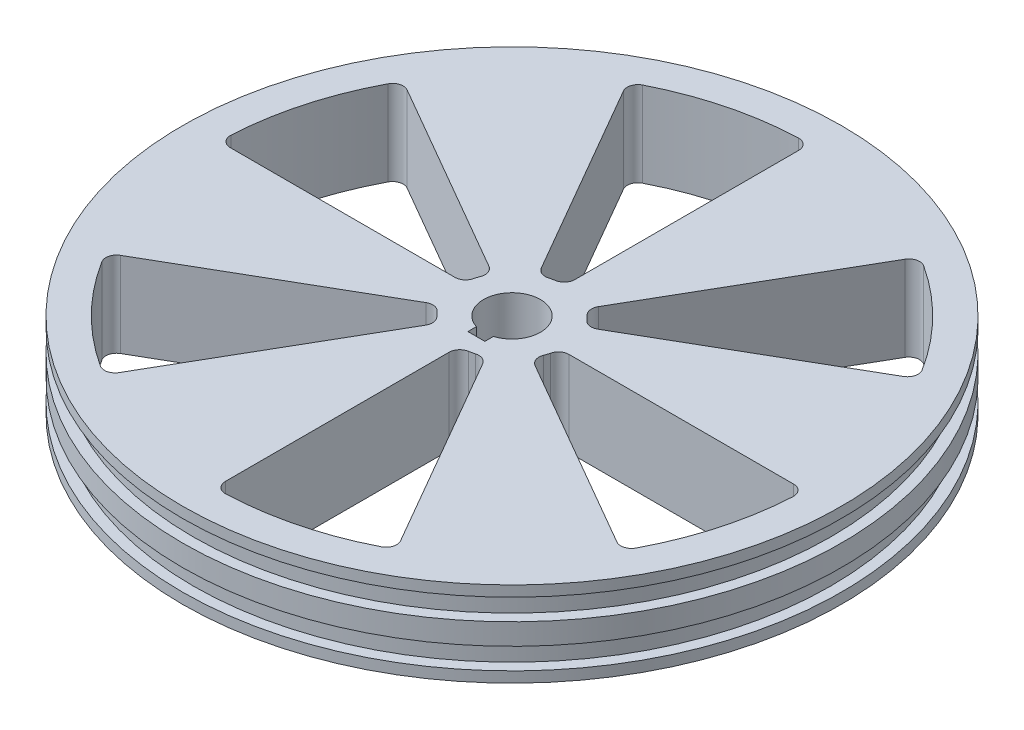
from build123d import *

# Parameters (mm, degrees)
CUT_EXTRUDE1_DEPTH = 223.822799552
CUT_EXTRUDE2_DEPTH = 223.822799552


with BuildPart() as part:
    # Sketch1 → Revolve1 (revolve)
    with BuildSketch(Plane(origin=(0, 0, 0), x_dir=(0, 0, -1), z_dir=(1, 0, 0))):
        Polygon((13.36858006, 0), (155, 0), (155, 5), (150, 5), (150, 15), (155, 15), (155, 25), (150, 25), (150, 35), (155, 35), (155, 40), (13.36858006, 40), align=None)
    revolve(axis=Axis((0, 0, 0), (0, 1, 0)))

    # Sketch2 → Cut-Extrude1 (cut, through all)
    with BuildSketch(Plane.XZ):
        with BuildLine():
            Line((-4, 16.756133146), (4, 16.756133146))
            Line((4, 16.756133146), (4, 12.756133146))
            ThreePointArc((4, 12.756133146), (0, 13.36858006), (-4, 12.756133146))
            Line((-4, 12.756133146), (-4, 16.756133146))
        make_face()
    extrude(amount=-CUT_EXTRUDE1_DEPTH, mode=Mode.SUBTRACT)

    # Sketch3 → Cut-Extrude2 (cut, through all)
    with BuildSketch(Plane.XZ):
        with BuildLine():
            Line((0, 29.580398915), (0, 134.82214713))
            ThreePointArc((0, 134.82214713), (1.530598787, 138.422599216), (5.18530209, 139.818712264))
            ThreePointArc((5.18530209, 139.818712264), (35.071098816, 135.448062683), (63.322556568, 124.765433861))
            ThreePointArc((63.322556568, 124.765433861), (65.852633094, 121.73068432), (65.389787061, 117.806813075))
            Line((65.389787061, 117.806813075), (12.582866204, 26.34254316))
            ThreePointArc((12.582866204, 26.34254316), (10.127088699, 24.207156024), (6.877282654, 24.035452633))
            ThreePointArc((6.877282654, 24.035452633), (5.530526507, 24.380592211), (4.166666667, 24.65033243))
            ThreePointArc((4.166666667, 24.65033243), (1.181186921, 26.352912794), (0, 29.580398915))
        make_face()
        with BuildLine():
            Line((25.617376915, 14.790199458), (116.759404407, 67.411073565))
            ThreePointArc((116.759404407, 67.411073565), (120.642786773, 67.885762175), (123.67920779, 65.418752795))
            ThreePointArc((123.67920779, 65.418752795), (134.837012585, 37.351568828), (139.711313522, 7.543774309))
            ThreePointArc((139.711313522, 7.543774309), (138.348181588, 3.835288995), (134.718586392, 2.274189795))
            Line((134.718586392, 2.274189795), (29.104744679, 2.274189795))
            ThreePointArc((29.104744679, 2.274189795), (26.027556419, 3.333261933), (24.253953899, 6.061824829))
            ThreePointArc((24.253953899, 6.061824829), (23.879475467, 7.400719654), (23.431147429, 8.716727032))
            ThreePointArc((23.431147429, 8.716727032), (23.412885403, 12.153518517), (25.617376915, 14.790199458))
        make_face()
        with BuildLine():
            Line((25.617376915, -14.790199458), (116.759404407, -67.411073565))
            ThreePointArc((116.759404407, -67.411073565), (119.112187985, -70.536837041), (118.4939057, -74.399959468))
            ThreePointArc((118.4939057, -74.399959468), (99.765913769, -98.096493855), (76.388756953, -117.221659551))
            ThreePointArc((76.388756953, -117.221659551), (72.495548494, -117.895395325), (69.328799331, -115.53262328))
            Line((69.328799331, -115.53262328), (16.521878475, -24.068353365))
            ThreePointArc((16.521878475, -24.068353365), (15.900467721, -20.873894091), (17.376671245, -17.973627804))
            ThreePointArc((17.376671245, -17.973627804), (18.348948961, -16.979872557), (19.264480762, -15.933605397))
            ThreePointArc((19.264480762, -15.933605397), (22.231698483, -14.199394277), (25.617376915, -14.790199458))
        make_face()
        with BuildLine():
            Line((0, -29.580398915), (0, -134.82214713))
            ThreePointArc((0, -134.82214713), (-1.530598787, -138.422599216), (-5.18530209, -139.818712264))
            ThreePointArc((-5.18530209, -139.818712264), (-35.071098816, -135.448062683), (-63.322556568, -124.765433861))
            ThreePointArc((-63.322556568, -124.765433861), (-65.852633094, -121.73068432), (-65.389787061, -117.806813075))
            Line((-65.389787061, -117.806813075), (-12.582866204, -26.34254316))
            ThreePointArc((-12.582866204, -26.34254316), (-10.127088699, -24.207156024), (-6.877282654, -24.035452633))
            ThreePointArc((-6.877282654, -24.035452633), (-5.530526507, -24.380592211), (-4.166666667, -24.65033243))
            ThreePointArc((-4.166666667, -24.65033243), (-1.181186921, -26.352912794), (0, -29.580398915))
        make_face()
        with BuildLine():
            Line((-25.617376915, -14.790199458), (-116.759404407, -67.411073565))
            ThreePointArc((-116.759404407, -67.411073565), (-120.642786773, -67.885762175), (-123.67920779, -65.418752795))
            ThreePointArc((-123.67920779, -65.418752795), (-134.837012585, -37.351568828), (-139.711313522, -7.543774309))
            ThreePointArc((-139.711313522, -7.543774309), (-138.348181588, -3.835288995), (-134.718586392, -2.274189795))
            Line((-134.718586392, -2.274189795), (-29.104744679, -2.274189795))
            ThreePointArc((-29.104744679, -2.274189795), (-26.027556419, -3.333261933), (-24.253953899, -6.061824829))
            ThreePointArc((-24.253953899, -6.061824829), (-23.879475467, -7.400719654), (-23.431147429, -8.716727032))
            ThreePointArc((-23.431147429, -8.716727032), (-23.412885403, -12.153518517), (-25.617376915, -14.790199458))
        make_face()
        with BuildLine():
            Line((-25.617376915, 14.790199458), (-116.759404407, 67.411073565))
            ThreePointArc((-116.759404407, 67.411073565), (-119.112187985, 70.536837041), (-118.4939057, 74.399959468))
            ThreePointArc((-118.4939057, 74.399959468), (-99.765913769, 98.096493855), (-76.388756953, 117.221659551))
            ThreePointArc((-76.388756953, 117.221659551), (-72.495548494, 117.895395325), (-69.328799331, 115.53262328))
            Line((-69.328799331, 115.53262328), (-16.521878475, 24.068353365))
            ThreePointArc((-16.521878475, 24.068353365), (-15.900467721, 20.873894091), (-17.376671245, 17.973627804))
            ThreePointArc((-17.376671245, 17.973627804), (-18.348948961, 16.979872557), (-19.264480762, 15.933605397))
            ThreePointArc((-19.264480762, 15.933605397), (-22.231698483, 14.199394277), (-25.617376915, 14.790199458))
        make_face()
    extrude(amount=-CUT_EXTRUDE2_DEPTH, mode=Mode.SUBTRACT)


solid = part.part
